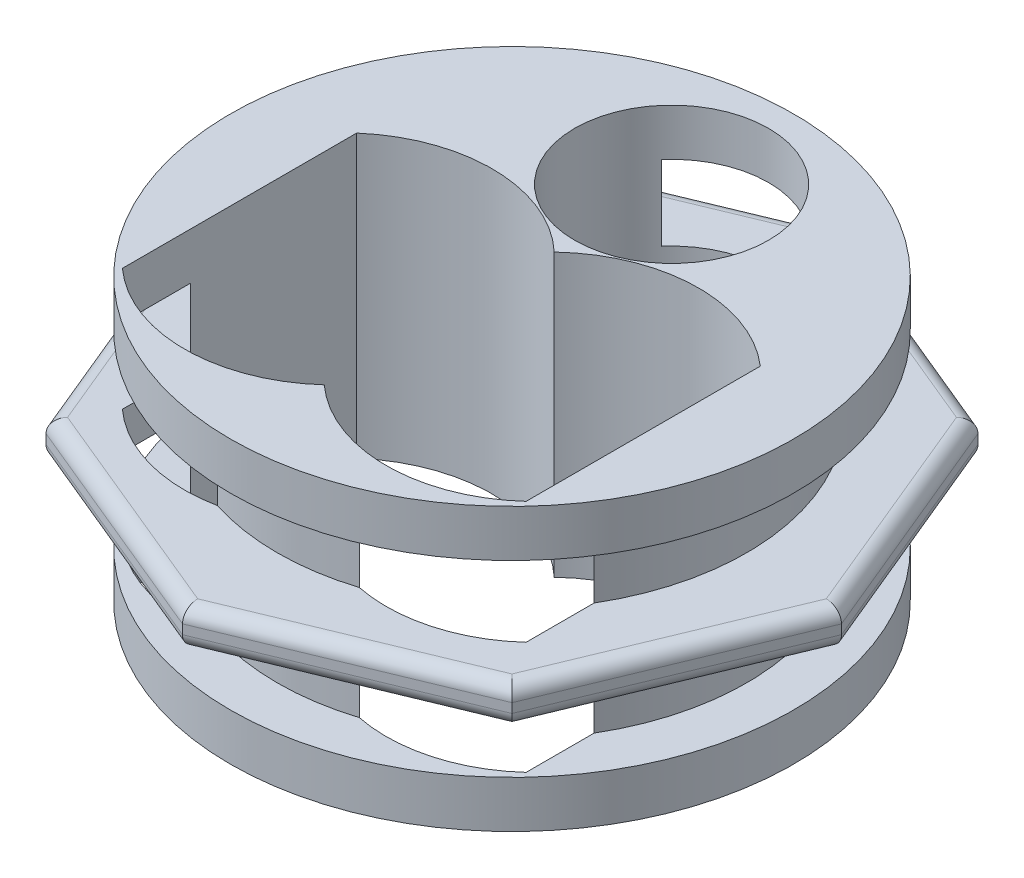
from build123d import *

# Parameters (mm, degrees)
BOSS_EXTRUDE1_DEPTH  = 2
SKETCH12_R           = 25
BOSS_EXTRUDE2_DEPTH  = 8
CUT_EXTRUDE6_START   = -36
SKETCH17_R           = 10.33
CUT_EXTRUDE6_DEPTH   = 45.856111051
SKETCH25_R           = 30
BOSS_EXTRUDE3_DEPTH  = 5
CUT_EXTRUDE9_START   = -5
SKETCH26_R           = 10.33
CUT_EXTRUDE9_DEPTH   = 5
CUT_EXTRUDE10_DEPTH  = 45
FILLET3_R            = 1.5
MIRROR9_COPY_1_DEPTH = 45
FILLET3_OF_MIRROR9_R = 1.5
CUT_EXTRUDE11_START  = -5
SKETCH29_R           = 10.33
CUT_EXTRUDE11_DEPTH  = 5


with BuildPart() as part:
    # Sketch3 → Boss-Extrude1 (new body)
    with BuildSketch(Plane(origin=(0, 0, 0), x_dir=(1, 0, 0), z_dir=(0, 1, 0))):
        Polygon((35.1, 0), (24.81944802, 24.81944802), (0, 35.1), (-24.81944802, 24.81944802), (-35.1, 0), (-24.81944802, -24.81944802), (0, -35.1), (24.81944802, -24.81944802), align=None)
    boss_extrude1 = extrude(amount=BOSS_EXTRUDE1_DEPTH)

    # Sketch12 → Boss-Extrude2 (add)
    with BuildSketch(Plane(origin=(0, 2, 0), x_dir=(1, 0, 0), z_dir=(0, 1, 0))):
        Circle(SKETCH12_R)
    boss_extrude2 = extrude(amount=BOSS_EXTRUDE2_DEPTH)

    # Sketch17 → Cut-Extrude6 (cut)
    with BuildSketch(Plane(origin=(0, 10, 0), x_dir=(1, 0, 0), z_dir=(0, 1, 0)).offset(CUT_EXTRUDE6_START)):
        with Locations((0, 17)):
            Circle(SKETCH17_R)
    cut_extrude6 = extrude(amount=CUT_EXTRUDE6_DEPTH, mode=Mode.SUBTRACT)

    # Sketch25 → Boss-Extrude3 (add)
    with BuildSketch(Plane(origin=(0, 10, 0), x_dir=(1, 0, 0), z_dir=(0, 1, 0))):
        Circle(SKETCH25_R)
    boss_extrude3 = extrude(amount=BOSS_EXTRUDE3_DEPTH)

    # Sketch26 → Cut-Extrude9 (cut)
    with BuildSketch(Plane(origin=(0, 15, 0), x_dir=(1, 0, 0), z_dir=(0, 1, 0)).offset(CUT_EXTRUDE9_START)):
        with Locations((0, 17)):
            Circle(SKETCH26_R)
    extrude(amount=CUT_EXTRUDE9_DEPTH, mode=Mode.SUBTRACT)

    # Sketch27 → Cut-Extrude10 (cut)
    with BuildSketch(Plane(origin=(0, 15, 0), x_dir=(1, 0, 0), z_dir=(0, 1, 0))):
        with BuildLine():
            Line((0, -20), (0, 4.5))
            ThreePointArc((0, 4.5), (-10.662403413, 8.877487957), (-21.5, 4.953746429))
            Line((-21.5, 4.953746429), (-21.5, -20))
            ThreePointArc((-21.5, -20), (-10.75, -24.149367106), (0, -20))
        make_face()
    cut_extrude10 = extrude(amount=-CUT_EXTRUDE10_DEPTH, mode=Mode.SUBTRACT)

    # Mirror8: Cut-Extrude10 across plane
    add(cut_extrude10.mirror(Plane.ZY), mode=Mode.SUBTRACT)

    # Fillet3
    fillet3_edges = [part.edges().sort_by_distance(p)[0] for p in [
        (12.40972401, 2, 29.95972401),
        (29.95972401, 2, 12.40972401),
        (-12.40972401, 2, 29.95972401),
        (-29.95972401, 2, 12.40972401),
        (-29.95972401, 2, -12.40972401),
        (29.95972401, 2, -12.40972401),
        (-12.40972401, 2, -29.95972401),
        (12.40972401, 2, -29.95972401),
    ]]
    fillet(fillet3_edges, radius=FILLET3_R)

    # Mirror9: Boss-Extrude1, Boss-Extrude2, Cut-Extrude6, Boss-Extrude3, Cut-Extrude10 across plane
    add(boss_extrude1.mirror(Plane.ZX))
    add(boss_extrude2.mirror(Plane.ZX))
    add(cut_extrude6.mirror(Plane.ZX), mode=Mode.SUBTRACT)
    add(boss_extrude3.mirror(Plane.ZX))
    add(cut_extrude10.mirror(Plane.ZX), mode=Mode.SUBTRACT)

    # Mirror9 copy 1 sketch → Mirror9 copy 1 (cut)
    with BuildSketch(Plane(origin=(0, -15, 0), x_dir=(-1, 0, 0), z_dir=(0, -1, 0))):
        with BuildLine():
            Line((0, -20), (0, 4.5))
            ThreePointArc((0, 4.5), (-10.662403413, 8.877487957), (-21.5, 4.953746429))
            Line((-21.5, 4.953746429), (-21.5, -20))
            ThreePointArc((-21.5, -20), (-10.75, -24.149367106), (0, -20))
        make_face()
    extrude(amount=-MIRROR9_COPY_1_DEPTH, mode=Mode.SUBTRACT)

    # Fillet3 of Mirror9
    fillet3_of_mirror9_edges = [part.edges().sort_by_distance(p)[0] for p in [
        (12.40972401, -2, 29.95972401),
        (29.95972401, -2, 12.40972401),
        (-12.40972401, -2, 29.95972401),
        (-29.95972401, -2, 12.40972401),
        (-29.95972401, -2, -12.40972401),
        (29.95972401, -2, -12.40972401),
        (-12.40972401, -2, -29.95972401),
        (12.40972401, -2, -29.95972401),
    ]]
    fillet(fillet3_of_mirror9_edges, radius=FILLET3_OF_MIRROR9_R)

    # Sketch29 → Cut-Extrude11 (cut)
    with BuildSketch(Plane.XZ.offset(15).offset(CUT_EXTRUDE11_START)):
        with Locations((0, -17)):
            Circle(SKETCH29_R)
    extrude(amount=CUT_EXTRUDE11_DEPTH, mode=Mode.SUBTRACT)


solid = part.part
